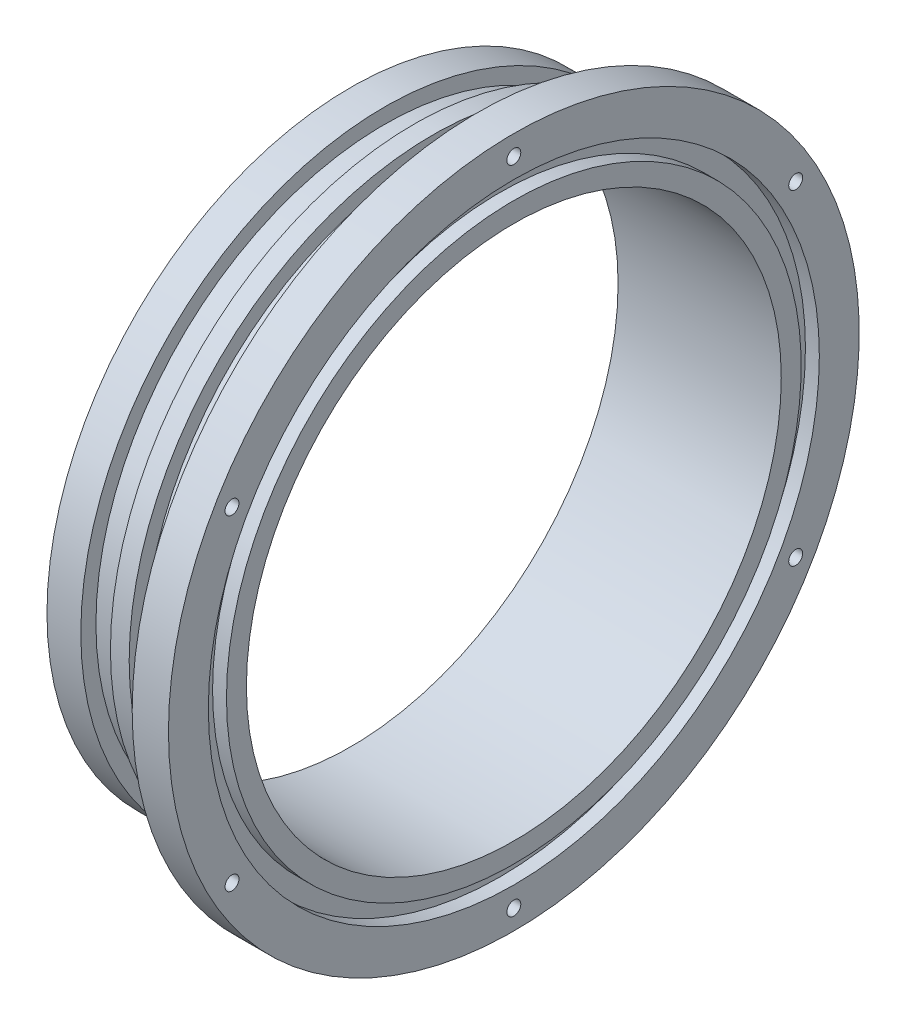
from build123d import *

# Parameters (mm, degrees)
ESQUISSE2_R             = 1.15
ENL_V_MAT_EXTRU_1_DEPTH = 86.212939158
ESQUISSE3_R             = 1.15
ENL_V_MAT_EXTRU_2_DEPTH = 5


with BuildPart() as part:
    # Esquisse1 → Révolution1 (revolve)
    with BuildSketch(Plane.XY, mode=Mode.PRIVATE) as r_volution1_sk:
        Polygon((0, 44.25), (27, 44.25), (27, 47.55), (24.7, 47.55), (24.7, 50.55), (27, 50.55), (27, 57.15), (21, 57.15), (21, 50.25), (18.4, 50.25), (18.4, 47.75), (13.6, 47.75), (13.6, 50.25), (10.5, 50.25), (10.5, 47.75), (5.6, 47.75), (5.6, 50.25), (0, 50.25), align=None)
    revolve(r_volution1_sk.sketch.rotate(Axis((0, 0, 0), (1, 0, 0)), 90), axis=Axis((0, 0, 0), (1, 0, 0)))

    # Esquisse2 → Enlèv. mat.-Extru.1 (cut, through all)
    with BuildSketch(Plane(origin=(27, 0, 0), x_dir=(0, 0, -1), z_dir=(1, 0, 0))):
        with Locations((0, 53.85)):
            Circle(ESQUISSE2_R)
        with Locations((46.635467994, 26.925)):
            Circle(ESQUISSE2_R)
        with Locations((46.635467994, -26.925)):
            Circle(ESQUISSE2_R)
        with Locations((0, -53.85)):
            Circle(ESQUISSE2_R)
        with Locations((-46.635467994, -26.925)):
            Circle(ESQUISSE2_R)
        with Locations((-46.635467994, 26.925)):
            Circle(ESQUISSE2_R)
    extrude(amount=-ENL_V_MAT_EXTRU_1_DEPTH, mode=Mode.SUBTRACT)

    # Esquisse3 → Enlèv. mat.-Extru.2 (cut)
    with BuildSketch(Plane.ZY):
        with Locations((0, -47)):
            Circle(ESQUISSE3_R)
        with Locations((-47, 0)):
            Circle(ESQUISSE3_R)
        with Locations((0, 47)):
            Circle(ESQUISSE3_R)
        with Locations((47, 0)):
            Circle(ESQUISSE3_R)
    extrude(amount=-ENL_V_MAT_EXTRU_2_DEPTH, mode=Mode.SUBTRACT)


solid = part.part
